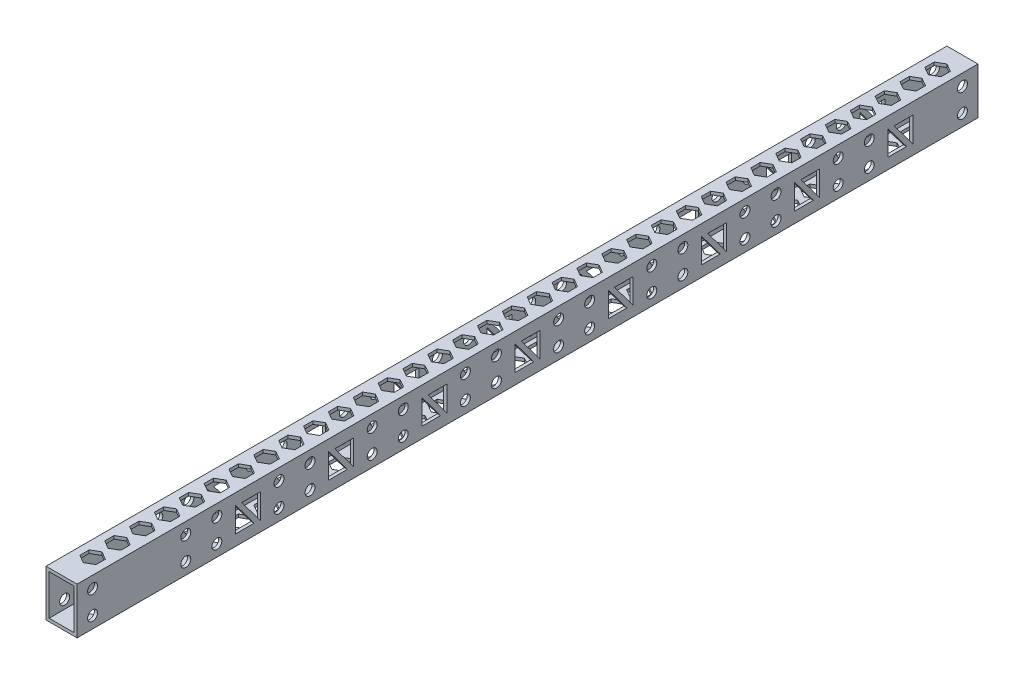
from build123d import *

# Parameters (mm, degrees)
SKETCH_1_W          = 10
SKETCH_1_H          = 15
SKETCH_1_W_2        = 8
SKETCH_1_H_2        = 13
EXTRUDE_1_DEPTH     = 290
SKETCH_2_R          = 1.6
CUT_EXTRUDE_1_DEPTH = 291.559804515
CUT_EXTRUDE_2_DEPTH = 291.559804515


with BuildPart() as part:
    # 草图1 → 拉伸-薄壁1 (new body)
    with BuildSketch(Plane.XY):
        with Locations((5, -7.5)):
            Rectangle(SKETCH_1_W, SKETCH_1_H)
        with Locations((5, -7.5)):
            Rectangle(SKETCH_1_W_2, SKETCH_1_H_2, mode=Mode.SUBTRACT)
    extrude(amount=EXTRUDE_1_DEPTH)

    # 草图2 → 切除-拉伸1 (cut, through all)
    with BuildSketch(Plane(origin=(10, 0, 0), x_dir=(0, 0, -1), z_dir=(1, 0, 0))):
        with Locations(Location((-285, -3.75, 0), (0, 0, 90))):
            Circle(SKETCH_2_R)
        with Locations(Location((-285, -11.25, 0), (0, 0, 180))):
            Circle(SKETCH_2_R)
        with Locations(Location((-5, -11.25, 0), (0, 0, 90))):
            Circle(SKETCH_2_R)
        with Locations(Location((-5, -3.75, 0), (0, 0, 180))):
            Circle(SKETCH_2_R)
        with Locations(Location((-255, -3.75, 0), (0, 0, 90))):
            Circle(SKETCH_2_R)
        with Locations(Location((-255, -11.25, 0), (0, 0, 180))):
            Circle(SKETCH_2_R)
        with Locations(Location((-245, -11.25, 0), (0, 0, 90))):
            Circle(SKETCH_2_R)
        with Locations(Location((-245, -3.75, 0), (0, 0, 180))):
            Circle(SKETCH_2_R)
        with Locations(Location((-225, -3.75, 0), (0, 0, 90))):
            Circle(SKETCH_2_R)
        with Locations(Location((-215, -3.75, 0), (0, 0, 180))):
            Circle(SKETCH_2_R)
        with Locations(Location((-215, -11.25, 0), (0, 0, 90))):
            Circle(SKETCH_2_R)
        with Locations(Location((-225, -11.25, 0), (0, 0, 180))):
            Circle(SKETCH_2_R)
        with Locations(Location((-195, -3.75, 0), (0, 0, 90))):
            Circle(SKETCH_2_R)
        with Locations(Location((-185, -3.75, 0), (0, 0, 180))):
            Circle(SKETCH_2_R)
        with Locations(Location((-185, -11.25, 0), (0, 0, 90))):
            Circle(SKETCH_2_R)
        with Locations(Location((-195, -11.25, 0), (0, 0, 180))):
            Circle(SKETCH_2_R)
        with Locations(Location((-165, -3.75, 0), (0, 0, 90))):
            Circle(SKETCH_2_R)
        with Locations(Location((-155, -3.75, 0), (0, 0, 180))):
            Circle(SKETCH_2_R)
        with Locations(Location((-155, -11.25, 0), (0, 0, 90))):
            Circle(SKETCH_2_R)
        with Locations(Location((-165, -11.25, 0), (0, 0, 180))):
            Circle(SKETCH_2_R)
        with Locations(Location((-135, -3.75, 0), (0, 0, 90))):
            Circle(SKETCH_2_R)
        with Locations(Location((-125, -3.75, 0), (0, 0, 180))):
            Circle(SKETCH_2_R)
        with Locations(Location((-125, -11.25, 0), (0, 0, 90))):
            Circle(SKETCH_2_R)
        with Locations(Location((-135, -11.25, 0), (0, 0, 180))):
            Circle(SKETCH_2_R)
        with Locations(Location((-105, -3.75, 0), (0, 0, 90))):
            Circle(SKETCH_2_R)
        with Locations(Location((-95, -3.75, 0), (0, 0, 180))):
            Circle(SKETCH_2_R)
        with Locations(Location((-95, -11.25, 0), (0, 0, 90))):
            Circle(SKETCH_2_R)
        with Locations(Location((-105, -11.25, 0), (0, 0, 180))):
            Circle(SKETCH_2_R)
        with Locations(Location((-75, -3.75, 0), (0, 0, 90))):
            Circle(SKETCH_2_R)
        with Locations(Location((-65, -3.75, 0), (0, 0, 180))):
            Circle(SKETCH_2_R)
        with Locations(Location((-65, -11.25, 0), (0, 0, 90))):
            Circle(SKETCH_2_R)
        with Locations(Location((-75, -11.25, 0), (0, 0, 180))):
            Circle(SKETCH_2_R)
        with Locations(Location((-45, -3.75, 0), (0, 0, 90))):
            Circle(SKETCH_2_R)
        with Locations(Location((-35, -3.75, 0), (0, 0, 180))):
            Circle(SKETCH_2_R)
        with Locations(Location((-35, -11.25, 0), (0, 0, 90))):
            Circle(SKETCH_2_R)
        with Locations(Location((-45, -11.25, 0), (0, 0, 180))):
            Circle(SKETCH_2_R)
        Polygon((-239, -3.5), (-239, -11.5), (-233, -11.5), align=None)
        Polygon((-237, -3.75), (-231, -3.75), (-231, -11.75), align=None)
        Polygon((-201, -3.75), (-201, -11.75), (-207, -3.75), align=None)
        Polygon((-203, -11.5), (-209, -3.5), (-209, -11.5), align=None)
        Polygon((-171, -3.75), (-171, -11.75), (-177, -3.75), align=None)
        Polygon((-173, -11.5), (-179, -3.5), (-179, -11.5), align=None)
        Polygon((-141, -3.75), (-141, -11.75), (-147, -3.75), align=None)
        Polygon((-143, -11.5), (-149, -3.5), (-149, -11.5), align=None)
        Polygon((-111, -3.75), (-111, -11.75), (-117, -3.75), align=None)
        Polygon((-113, -11.5), (-119, -3.5), (-119, -11.5), align=None)
        Polygon((-81, -3.75), (-81, -11.75), (-87, -3.75), align=None)
        Polygon((-83, -11.5), (-89, -3.5), (-89, -11.5), align=None)
        Polygon((-51, -3.75), (-51, -11.75), (-57, -3.75), align=None)
        Polygon((-53, -11.5), (-59, -3.5), (-59, -11.5), align=None)
        Polygon((-21, -3.75), (-21, -11.75), (-27, -3.75), align=None)
        Polygon((-23, -11.5), (-29, -3.5), (-29, -11.5), align=None)
    extrude(amount=-CUT_EXTRUDE_1_DEPTH, mode=Mode.SUBTRACT)

    # 草图3 → 切除-拉伸2 (cut, through all)
    with BuildSketch(Plane(origin=(0, 0, 0), x_dir=(1, 0, 0), z_dir=(0, 1, 0))):
        Polygon((5, -11), (7.598076211, -9.5), (7.598076211, -6.5), (5, -5), (2.401923789, -6.5), (2.401923789, -9.5), align=None)
        Polygon((5, -13), (2.401923789, -14.5), (2.401923789, -17.5), (5, -19), (7.598076211, -17.5), (7.598076211, -14.5), align=None)
        Polygon((5, -21), (2.401923789, -22.5), (2.401923789, -25.5), (5, -27), (7.598076211, -25.5), (7.598076211, -22.5), align=None)
        Polygon((5, -29), (2.401923789, -30.5), (2.401923789, -33.5), (5, -35), (7.598076211, -33.5), (7.598076211, -30.5), align=None)
        Polygon((5, -37), (2.401923789, -38.5), (2.401923789, -41.5), (5, -43), (7.598076211, -41.5), (7.598076211, -38.5), align=None)
        Polygon((5, -45), (2.401923789, -46.5), (2.401923789, -49.5), (5, -51), (7.598076211, -49.5), (7.598076211, -46.5), align=None)
        Polygon((5, -53), (2.401923789, -54.5), (2.401923789, -57.5), (5, -59), (7.598076211, -57.5), (7.598076211, -54.5), align=None)
        Polygon((5, -61), (2.401923789, -62.5), (2.401923789, -65.5), (5, -67), (7.598076211, -65.5), (7.598076211, -62.5), align=None)
        Polygon((5, -69), (2.401923789, -70.5), (2.401923789, -73.5), (5, -75), (7.598076211, -73.5), (7.598076211, -70.5), align=None)
        Polygon((5, -77), (2.401923789, -78.5), (2.401923789, -81.5), (5, -83), (7.598076211, -81.5), (7.598076211, -78.5), align=None)
        Polygon((5, -85), (2.401923789, -86.5), (2.401923789, -89.5), (5, -91), (7.598076211, -89.5), (7.598076211, -86.5), align=None)
        Polygon((5, -93), (2.401923789, -94.5), (2.401923789, -97.5), (5, -99), (7.598076211, -97.5), (7.598076211, -94.5), align=None)
        Polygon((5, -101), (2.401923789, -102.5), (2.401923789, -105.5), (5, -107), (7.598076211, -105.5), (7.598076211, -102.5), align=None)
        Polygon((5, -109), (2.401923789, -110.5), (2.401923789, -113.5), (5, -115), (7.598076211, -113.5), (7.598076211, -110.5), align=None)
        Polygon((5, -117), (2.401923789, -118.5), (2.401923789, -121.5), (5, -123), (7.598076211, -121.5), (7.598076211, -118.5), align=None)
        Polygon((5, -125), (2.401923789, -126.5), (2.401923789, -129.5), (5, -131), (7.598076211, -129.5), (7.598076211, -126.5), align=None)
        Polygon((5, -133), (2.401923789, -134.5), (2.401923789, -137.5), (5, -139), (7.598076211, -137.5), (7.598076211, -134.5), align=None)
        Polygon((5, -141), (2.401923789, -142.5), (2.401923789, -145.5), (5, -147), (7.598076211, -145.5), (7.598076211, -142.5), align=None)
        Polygon((5, -149), (2.401923789, -150.5), (2.401923789, -153.5), (5, -155), (7.598076211, -153.5), (7.598076211, -150.5), align=None)
        Polygon((5, -157), (2.401923789, -158.5), (2.401923789, -161.5), (5, -163), (7.598076211, -161.5), (7.598076211, -158.5), align=None)
        Polygon((5, -165), (2.401923789, -166.5), (2.401923789, -169.5), (5, -171), (7.598076211, -169.5), (7.598076211, -166.5), align=None)
        Polygon((5, -173), (2.401923789, -174.5), (2.401923789, -177.5), (5, -179), (7.598076211, -177.5), (7.598076211, -174.5), align=None)
        Polygon((5, -181), (2.401923789, -182.5), (2.401923789, -185.5), (5, -187), (7.598076211, -185.5), (7.598076211, -182.5), align=None)
        Polygon((5, -189), (2.401923789, -190.5), (2.401923789, -193.5), (5, -195), (7.598076211, -193.5), (7.598076211, -190.5), align=None)
        Polygon((5, -197), (2.401923789, -198.5), (2.401923789, -201.5), (5, -203), (7.598076211, -201.5), (7.598076211, -198.5), align=None)
        Polygon((5, -205), (2.401923789, -206.5), (2.401923789, -209.5), (5, -211), (7.598076211, -209.5), (7.598076211, -206.5), align=None)
        Polygon((5, -213), (2.401923789, -214.5), (2.401923789, -217.5), (5, -219), (7.598076211, -217.5), (7.598076211, -214.5), align=None)
        Polygon((5, -221), (2.401923789, -222.5), (2.401923789, -225.5), (5, -227), (7.598076211, -225.5), (7.598076211, -222.5), align=None)
        Polygon((5, -229), (2.401923789, -230.5), (2.401923789, -233.5), (5, -235), (7.598076211, -233.5), (7.598076211, -230.5), align=None)
        Polygon((5, -237), (2.401923789, -238.5), (2.401923789, -241.5), (5, -243), (7.598076211, -241.5), (7.598076211, -238.5), align=None)
        Polygon((5, -245), (2.401923789, -246.5), (2.401923789, -249.5), (5, -251), (7.598076211, -249.5), (7.598076211, -246.5), align=None)
        Polygon((5, -253), (2.401923789, -254.5), (2.401923789, -257.5), (5, -259), (7.598076211, -257.5), (7.598076211, -254.5), align=None)
        Polygon((5, -261), (2.401923789, -262.5), (2.401923789, -265.5), (5, -267), (7.598076211, -265.5), (7.598076211, -262.5), align=None)
        Polygon((5, -269), (2.401923789, -270.5), (2.401923789, -273.5), (5, -275), (7.598076211, -273.5), (7.598076211, -270.5), align=None)
        Polygon((5, -277), (2.401923789, -278.5), (2.401923789, -281.5), (5, -283), (7.598076211, -281.5), (7.598076211, -278.5), align=None)
    extrude(amount=-CUT_EXTRUDE_2_DEPTH, mode=Mode.SUBTRACT)


solid = part.part
